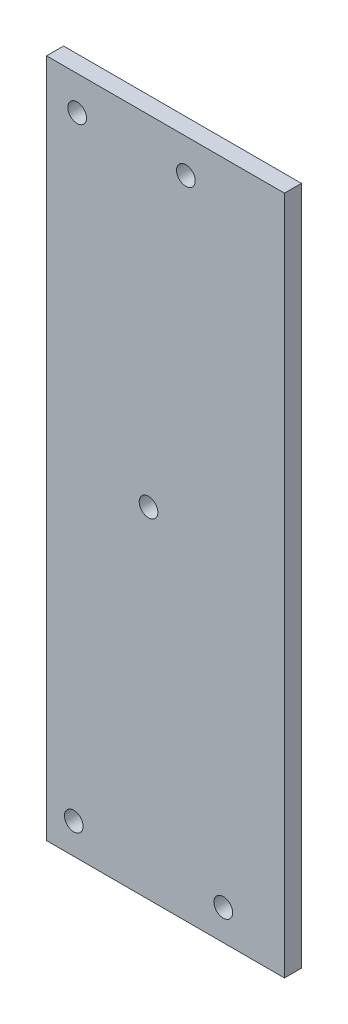
from build123d import *

# Parameters (mm, degrees)
SKETCH_1_W          = 100
SKETCH_1_H          = 200
EXTRUDE_1_DEPTH     = 5
CUT_EXTRUDE_2_DEPTH = 0.001
SKETCH_13_W         = 10
SKETCH_13_H         = 200
CUT_EXTRUDE_4_DEPTH = 10
SKETCH_14_W         = 10
SKETCH_14_H         = 200
CUT_EXTRUDE_5_DEPTH = 10
SKETCH_15_R         = 2.75
CUT_EXTRUDE_6_DEPTH = 108.819293394
SKETCH_17_R         = 2.75
CUT_EXTRUDE_8_DEPTH = 10
SKETCH_18_R         = 2.75
CUT_EXTRUDE_9_DEPTH = 10


with BuildPart() as part:
    # 스케치1 → 보스-돌출1 (new body)
    with BuildSketch(Plane.XY):
        Rectangle(SKETCH_1_W, SKETCH_1_H)
    extrude(amount=EXTRUDE_1_DEPTH)

    # 스케치3 → 컷-돌출2 (cut)
    # profile 1 of 5: a face of its own
    with BuildSketch(Plane(origin=(0, 0, 0), x_dir=(-1, 0, 0), z_dir=(0, 0, -1))):
        with BuildLine():
            Line((1.435897436, 3.568709936), (1.435897436, 3.241987179))
            add(Edge.make_bspline(
                [(1.435897436, 3.241987179), (1.406158657, 3.253938052), (1.349713836, 3.276621056), (1.26647346, 3.301285681), (1.189944626, 3.317221421), (1.140790736, 3.319457366), (1.117588141, 3.320512821)],
                knots=[0, 0, 0, 0, 1.16548392, 2.212112691, 3.15604595, 4, 4, 4, 4], degree=3))
            add(Edge.make_bspline(
                [(1.117588141, 3.320512821), (1.101914377, 3.31986148), (1.071575198, 3.318600703), (1.027971871, 3.312172427), (0.988682661, 3.299069626), (0.953777041, 3.28204035), (0.924826581, 3.260686166), (0.900040357, 3.239230902), (0.882073827, 3.215045722), (0.872318879, 3.192525311), (0.866368878, 3.171674318), (0.86457875, 3.150320052), (0.860193836, 3.124095966), (0.858971029, 3.091932248), (0.856183661, 3.054829537), (0.856430302, 3.012002641), (0.854146379, 2.964125498), (0.854488293, 2.930224949), (0.854667468, 2.912459936)],
                knots=[0, 0, 0, 0, 1.311993654, 2.539582093, 3.670788641, 4.763509788, 5.772417512, 6.671800701, 7.496729179, 8.266799162, 8.712543678, 9.304149002, 10.05334463, 10.934920737, 11.99209668, 13.165090968, 14.514413552, 16, 16, 16, 16], degree=3))
            Line((0.854667468, 2.912459936), (0.854667468, 2.557692308))
            Line((0.854667468, 2.557692308), (1.391025641, 2.557692308))
            Line((1.391025641, 2.557692308), (1.391025641, 2.243589744))
            Line((1.391025641, 2.243589744), (0.853966346, 2.243589744))
            Line((0.853966346, 2.243589744), (0.852564103, 0))
            Line((0.852564103, 0), (0.538461538, 0))
            Line((0.538461538, 0), (0.538461538, 2.243589744))
            Line((0.538461538, 2.243589744), (0.179487179, 2.243589744))
            Line((0.179487179, 2.243589744), (0.179487179, 2.557692308))
            Line((0.179487179, 2.557692308), (0.538461538, 2.557692308))
            Line((0.538461538, 2.557692308), (0.538461538, 2.966446314))
            add(Edge.make_bspline(
                [(0.538461538, 2.966446314), (0.538486753, 2.989121894), (0.538535124, 3.032622798), (0.541922975, 3.095232239), (0.544818696, 3.153055703), (0.550586323, 3.205644336), (0.557248029, 3.253490479), (0.566784189, 3.29588336), (0.57579556, 3.333965119), (0.592144152, 3.377067776), (0.616566371, 3.4259178), (0.656096568, 3.4775417), (0.703489575, 3.523846647), (0.760097899, 3.562854), (0.823813434, 3.595269478), (0.894694612, 3.618511331), (0.97196981, 3.631651776), (1.02545728, 3.633605985), (1.053084936, 3.634615385)],
                knots=[0, 0, 0, 0, 1.116398763, 2.141702935, 3.087165306, 3.966655413, 4.746276475, 5.464069668, 6.106083417, 6.67047701, 7.730773247, 8.782666744, 9.856985883, 10.980834087, 12.154321827, 13.366232824, 14.639591414, 16, 16, 16, 16], degree=3))
            add(Edge.make_bspline(
                [(1.053084936, 3.634615385), (1.081161694, 3.633658004), (1.140107358, 3.631648034), (1.232303961, 3.619214627), (1.331900478, 3.597743597), (1.400236399, 3.578665712), (1.435897436, 3.568709936)],
                knots=[0, 0, 0, 0, 0.864728408, 1.815451418, 2.859995356, 4, 4, 4, 4], degree=3))
        make_face()
    # profile 2 of 5: a face of its own
    with BuildSketch(Plane(origin=(0, 0, 0), x_dir=(-1, 0, 0), z_dir=(0, 0, -1))):
        with BuildLine():
            Line((1.794871795, 2.557692308), (2.108974359, 2.557692308))
            Line((2.108974359, 2.557692308), (2.108974359, 2.181189904))
            add(Edge.make_bspline(
                [(2.108974359, 2.181189904), (2.132163118, 2.216245732), (2.176511439, 2.283289731), (2.250224368, 2.371959032), (2.325727699, 2.445374079), (2.403382887, 2.503877598), (2.483760987, 2.547690717), (2.565097938, 2.579783752), (2.648673408, 2.598761067), (2.704835332, 2.601294726), (2.732972756, 2.602564103)],
                knots=[0, 0, 0, 0, 1.2804753, 2.448899062, 3.506932113, 4.484331642, 5.4025378, 6.288909075, 7.142734305, 8, 8, 8, 8], degree=3))
            add(Edge.make_bspline(
                [(2.732972756, 2.602564103), (2.754799083, 2.601373576), (2.799708168, 2.59892399), (2.867690758, 2.581713165), (2.93773421, 2.554235143), (2.982876597, 2.52839492), (3.006410256, 2.514923878)],
                knots=[0, 0, 0, 0, 0.901110191, 1.854092781, 2.881294221, 4, 4, 4, 4], degree=3))
            Line((3.006410256, 2.514923878), (2.833934295, 2.242888622))
            add(Edge.make_bspline(
                [(2.833934295, 2.242888622), (2.818825274, 2.249628888), (2.790145459, 2.262423203), (2.748190893, 2.277565213), (2.709509556, 2.286481129), (2.684865998, 2.287831847), (2.673377404, 2.288461538)],
                knots=[0, 0, 0, 0, 1.180555205, 2.24091978, 3.179933427, 4, 4, 4, 4], degree=3))
            add(Edge.make_bspline(
                [(2.673377404, 2.288461538), (2.64817167, 2.286781501), (2.59675928, 2.283354712), (2.521274781, 2.256415904), (2.448027575, 2.212890664), (2.389855913, 2.164619552), (2.34481366, 2.118071755), (2.312673435, 2.077423352), (2.283190688, 2.031844721), (2.255020467, 1.982115037), (2.229354173, 1.927385191), (2.205399504, 1.868201977), (2.183740641, 1.804496849), (2.171390397, 1.760114328), (2.165064103, 1.737379808)],
                knots=[0, 0, 0, 0, 1.125678352, 2.296057538, 3.5422874, 4.923748041, 5.663163013, 6.437101912, 7.23742474, 8.08941207, 8.991984279, 9.93940061, 10.944477711, 12, 12, 12, 12], degree=3))
            add(Edge.make_bspline(
                [(2.165064103, 1.737379808), (2.160331709, 1.717102634), (2.149849818, 1.672190235), (2.13965828, 1.596841711), (2.129588762, 1.507818052), (2.122492143, 1.404871459), (2.115914101, 1.288259015), (2.112204019, 1.15780307), (2.109100878, 1.013369718), (2.109017812, 0.912395365), (2.108974359, 0.859575321)],
                knots=[0, 0, 0, 0, 0.566838948, 1.255505196, 2.06880316, 3.007127437, 4.065329342, 5.249902469, 6.561414163, 8, 8, 8, 8], degree=3))
            Line((2.108974359, 0.859575321), (2.108974359, 0))
            Line((2.108974359, 0), (1.794871795, 0))
            Line((1.794871795, 0), (1.794871795, 2.557692308))
        make_face()
    # profile 3 of 5: a face of its own
    with BuildSketch(Plane(origin=(0, 0, 0), x_dir=(-1, 0, 0), z_dir=(0, 0, -1))):
        with BuildLine():
            add(Edge.make_bspline(
                [(4.555889423, 2.602564103), (4.603880696, 2.601542211), (4.697979853, 2.599538533), (4.835787739, 2.578123567), (4.967332875, 2.545376203), (5.093119067, 2.500104641), (5.211535363, 2.43942269), (5.324306607, 2.367013399), (5.431123616, 2.281230805), (5.495146645, 2.214872737), (5.527644231, 2.181189904)],
                knots=[0, 0, 0, 0, 1.054011418, 2.066658804, 3.057071809, 4.030435133, 4.997543892, 5.974964718, 6.972108034, 8, 8, 8, 8], degree=3))
            add(Edge.make_bspline(
                [(5.527644231, 2.181189904), (5.555626185, 2.148975918), (5.611048565, 2.085171376), (5.682114284, 1.981715763), (5.743335844, 1.874575662), (5.792398805, 1.762328336), (5.831083829, 1.645953664), (5.858549525, 1.525051653), (5.87488646, 1.399889306), (5.877089427, 1.314885468), (5.878205128, 1.271834936)],
                knots=[0, 0, 0, 0, 1.025258237, 2.030674902, 3.01204498, 3.988269485, 4.97094183, 5.956517959, 6.965070386, 8, 8, 8, 8], degree=3))
            add(Edge.make_bspline(
                [(5.878205128, 1.271834936), (5.877223791, 1.228534878), (5.875284623, 1.142971945), (5.856941006, 1.016952579), (5.82840992, 0.894757756), (5.787578082, 0.776899063), (5.735219973, 0.663016235), (5.671329285, 0.553606686), (5.595457668, 0.448454553), (5.509453671, 0.348452714), (5.414401795, 0.2562865), (5.311285647, 0.17595823), (5.202131613, 0.107136706), (5.08548826, 0.05170029), (4.962420773, 0.00799059), (4.832663705, -0.022709427), (4.696418635, -0.04127111), (4.603391413, -0.043654684), (4.555889423, -0.044871795)],
                knots=[0, 0, 0, 0, 0.998656419, 1.973391657, 2.932242238, 3.890759089, 4.846373663, 5.82037756, 6.809684879, 7.83454468, 8.860553229, 9.859544525, 10.845671541, 11.83227036, 12.833544569, 13.85385346, 14.904124723, 16, 16, 16, 16], degree=3))
            add(Edge.make_bspline(
                [(4.555889423, -0.044871795), (4.508154704, -0.043650599), (4.414663844, -0.041258824), (4.277937862, -0.022781541), (4.147948243, 0.007976441), (4.024719644, 0.051843934), (3.907574798, 0.107138478), (3.797788301, 0.175750167), (3.694588385, 0.256310322), (3.599516401, 0.348446259), (3.513517795, 0.448456216), (3.437644787, 0.553606254), (3.373754461, 0.663016348), (3.321396257, 0.776899033), (3.280564444, 0.894757764), (3.252033351, 1.016952577), (3.233689737, 1.142971945), (3.231750568, 1.228534878), (3.230769231, 1.271834936)],
                knots=[0, 0, 0, 0, 1.099876186, 2.154163076, 3.173186993, 4.173200201, 5.163417411, 6.152872554, 7.150605724, 8.17532212, 9.198891216, 10.186952605, 11.159729845, 12.11414092, 13.071450619, 14.029093627, 15.002601286, 16, 16, 16, 16], degree=3))
            add(Edge.make_bspline(
                [(3.230769231, 1.271834936), (3.231892541, 1.314651482), (3.234116503, 1.399420884), (3.250437012, 1.524347945), (3.277795568, 1.645045334), (3.316526965, 1.76097081), (3.366042155, 1.872726246), (3.426403443, 1.980131077), (3.498194076, 2.083118877), (3.553396027, 2.146840957), (3.581330128, 2.179086538)],
                knots=[0, 0, 0, 0, 1.031353054, 2.041901799, 3.029428768, 4.008703097, 4.981709435, 5.96992636, 6.972712378, 8, 8, 8, 8], degree=3))
            add(Edge.make_bspline(
                [(3.581330128, 2.179086538), (3.613778719, 2.213061478), (3.677594583, 2.279879174), (3.784943311, 2.365411698), (3.897437132, 2.439327772), (4.017162058, 2.498803987), (4.142844916, 2.545642505), (4.275064159, 2.57820802), (4.413339674, 2.599461375), (4.507899295, 2.601519553), (4.555889423, 2.602564103)],
                knots=[0, 0, 0, 0, 1.027980169, 2.021703884, 2.998553061, 3.971491411, 4.943284454, 5.930300938, 6.949603206, 8, 8, 8, 8], degree=3))
        make_face()
        with BuildLine():
            add(Edge.make_bspline(
                [(4.554487179, 2.288461538), (4.520549568, 2.287496947), (4.453550439, 2.285592664), (4.354930855, 2.27110876), (4.259990701, 2.248161255), (4.168549857, 2.215557199), (4.080916684, 2.1734583), (3.997007282, 2.12174994), (3.916574842, 2.061116984), (3.841192779, 1.991654312), (3.772010466, 1.915775317), (3.71153249, 1.834926959), (3.660107384, 1.750420612), (3.617267225, 1.662168401), (3.585360036, 1.569275987), (3.562187014, 1.472795356), (3.547716774, 1.37252994), (3.545830395, 1.304368921), (3.544871795, 1.269731571)],
                knots=[0, 0, 0, 0, 1.021534396, 2.016698045, 2.994645724, 3.958388632, 4.93408049, 5.916473867, 6.921342795, 7.962252576, 8.998418191, 10.008913653, 10.997312074, 11.973003931, 12.956656626, 13.948281152, 14.957379055, 16, 16, 16, 16], degree=3))
            add(Edge.make_bspline(
                [(3.544871795, 1.269731571), (3.546478619, 1.224979543), (3.549667863, 1.136155138), (3.575603099, 1.005344015), (3.618989379, 0.879762163), (3.677576659, 0.760145777), (3.750982878, 0.649473499), (3.837469944, 0.550802015), (3.936109645, 0.465616203), (4.045726145, 0.394935358), (4.164080463, 0.338775602), (4.289336784, 0.298976626), (4.419977478, 0.273104934), (4.509258209, 0.270533459), (4.554487179, 0.269230769)],
                knots=[0, 0, 0, 0, 1.016792936, 2.018143844, 3.017858371, 4.030088057, 5.03801393, 6.028138512, 7.003788237, 7.991172063, 8.984598303, 9.972568034, 10.972917682, 12, 12, 12, 12], degree=3))
            add(Edge.make_bspline(
                [(4.554487179, 0.269230769), (4.599713548, 0.270541049), (4.688989144, 0.273127506), (4.819448321, 0.298846326), (4.944362293, 0.338949987), (5.062593681, 0.394872197), (5.172160284, 0.465884611), (5.271509405, 0.550320988), (5.357258017, 0.64973484), (5.430591621, 0.760292369), (5.490138364, 0.879576721), (5.533321566, 1.005367193), (5.559319152, 1.136149235), (5.562499981, 1.224977566), (5.564102564, 1.269731571)],
                knots=[0, 0, 0, 0, 1.02726834, 2.027799167, 3.010890988, 4.004497153, 4.992059811, 5.971914811, 6.958719428, 7.966827853, 8.981595046, 9.981490638, 10.983022906, 12, 12, 12, 12], degree=3))
            add(Edge.make_bspline(
                [(5.564102564, 1.269731571), (5.563144294, 1.304369128), (5.561258565, 1.372530554), (5.546783601, 1.472793007), (5.523628061, 1.569284604), (5.491656444, 1.662136607), (5.44900243, 1.750649112), (5.396585637, 1.834678839), (5.336354611, 1.916055385), (5.26633749, 1.991409026), (5.191034113, 2.061144062), (5.110569074, 2.121773452), (5.026784096, 2.173231047), (4.939405513, 2.215917288), (4.847952945, 2.247864628), (4.753145816, 2.271241259), (4.654947006, 2.285531456), (4.588187963, 2.287478598), (4.554487179, 2.288461538)],
                knots=[0, 0, 0, 0, 1.042956736, 2.052379634, 3.044323526, 4.02829302, 5.004299113, 5.996692471, 7.007513377, 8.048758398, 9.090003419, 10.095195979, 11.07790575, 12.047570684, 13.018257071, 13.989683339, 14.985167495, 16, 16, 16, 16], degree=3))
        make_face(mode=Mode.SUBTRACT)
    # profile 4 of 5: a face of its own
    with BuildSketch(Plane(origin=(0, 0, 0), x_dir=(-1, 0, 0), z_dir=(0, 0, -1))):
        with BuildLine():
            Line((6.506410256, 2.557692308), (6.820512821, 2.557692308))
            Line((6.820512821, 2.557692308), (6.820512821, 2.096354167))
            add(Edge.make_bspline(
                [(6.820512821, 2.096354167), (6.854050456, 2.13819689), (6.919131407, 2.219394153), (7.02751574, 2.326114728), (7.14205964, 2.414059953), (7.262061644, 2.484163747), (7.387684654, 2.537010373), (7.518162924, 2.575176304), (7.65427763, 2.598061132), (7.746842067, 2.601051363), (7.793669872, 2.602564103)],
                knots=[0, 0, 0, 0, 1.12780773, 2.188550248, 3.19190651, 4.159438251, 5.104880172, 6.052711206, 7.014878035, 8, 8, 8, 8], degree=3))
            add(Edge.make_bspline(
                [(7.793669872, 2.602564103), (7.841000506, 2.600818907), (7.933637974, 2.597403139), (8.068516035, 2.570386448), (8.194489429, 2.524241192), (8.311108985, 2.461029122), (8.416236198, 2.382422649), (8.508561049, 2.290844867), (8.584924297, 2.185508784), (8.63612166, 2.087785627), (8.669847307, 2.001096833), (8.691079645, 1.926850083), (8.709110626, 1.844131932), (8.724742374, 1.753192343), (8.735319486, 1.653394153), (8.743661778, 1.545146461), (8.749640472, 1.42848433), (8.749877679, 1.347797703), (8.75, 1.306189904)],
                knots=[0, 0, 0, 0, 1.235846778, 2.418850247, 3.575807741, 4.728682307, 5.871620074, 6.994088408, 8.11269785, 9.256955736, 9.865816715, 10.540099792, 11.271859618, 12.076849838, 12.949306005, 13.892391288, 14.913166135, 16, 16, 16, 16], degree=3))
            Line((8.75, 1.306189904), (8.75, 0))
            Line((8.75, 0), (8.435897436, 0))
            Line((8.435897436, 0), (8.435897436, 1.203125))
            add(Edge.make_bspline(
                [(8.435897436, 1.203125), (8.435704228, 1.237947445), (8.435334654, 1.304556856), (8.434169007, 1.399925879), (8.431359201, 1.486412457), (8.427410888, 1.563809825), (8.421631857, 1.632043661), (8.415609226, 1.691252938), (8.408244249, 1.74136248), (8.401681336, 1.771527563), (8.398737981, 1.78505609)],
                knots=[0, 0, 0, 0, 1.430800155, 2.736877192, 3.918605307, 4.986035426, 5.920637409, 6.731861385, 7.431261377, 8, 8, 8, 8], degree=3))
            add(Edge.make_bspline(
                [(8.398737981, 1.78505609), (8.388112449, 1.824767275), (8.367661589, 1.901199019), (8.317127605, 2.004873372), (8.253313425, 2.09307156), (8.175415575, 2.165248281), (8.0841865, 2.221419118), (7.979879357, 2.260393073), (7.863500716, 2.284769342), (7.781646334, 2.287196474), (7.738982372, 2.288461538)],
                knots=[0, 0, 0, 0, 1.084156227, 2.086665306, 3.027808233, 3.945421172, 4.874247719, 5.839848303, 6.874090471, 8, 8, 8, 8], degree=3))
            add(Edge.make_bspline(
                [(7.738982372, 2.288461538), (7.713714688, 2.287985534), (7.663710595, 2.287043533), (7.589560623, 2.277592235), (7.51763645, 2.262133779), (7.447216241, 2.241265142), (7.379708447, 2.212602873), (7.312944156, 2.180073502), (7.249437392, 2.13952529), (7.187833995, 2.094334669), (7.130521187, 2.044255462), (7.077192849, 1.991410952), (7.029654829, 1.935135348), (6.986586153, 1.8763354), (6.94940789, 1.814203562), (6.916954802, 1.749339256), (6.889419107, 1.681657107), (6.875736415, 1.634682046), (6.868890224, 1.611177885)],
                knots=[0, 0, 0, 0, 1.023777757, 2.026029729, 3.023749952, 4.003683103, 4.997618607, 5.993177895, 7.010360494, 8.046726602, 9.087585522, 10.09234134, 11.086953743, 12.070360549, 13.043493632, 14.017870808, 15.008233677, 16, 16, 16, 16], degree=3))
            add(Edge.make_bspline(
                [(6.868890224, 1.611177885), (6.864950576, 1.593922682), (6.856374167, 1.556359007), (6.847110987, 1.494714588), (6.838703412, 1.423404613), (6.831666453, 1.342512296), (6.827361037, 1.251754421), (6.82266664, 1.151518583), (6.820957579, 1.041405094), (6.820665225, 0.964743402), (6.820512821, 0.924779647)],
                knots=[0, 0, 0, 0, 0.615963638, 1.340920617, 2.168419149, 3.115676021, 4.16674242, 5.331190069, 6.6087489, 8, 8, 8, 8], degree=3))
            Line((6.820512821, 0.924779647), (6.820512821, 0))
            Line((6.820512821, 0), (6.506410256, 0))
            Line((6.506410256, 0), (6.506410256, 2.557692308))
        make_face()
    # profile 5 of 5: a face of its own
    with BuildSketch(Plane(origin=(0, 0, 0), x_dir=(-1, 0, 0), z_dir=(0, 0, -1))):
        Polygon((9.782051282, 3.58974359), (10.096153846, 3.58974359), (10.096153846, 2.557692308), (10.544871795, 2.557692308), (10.544871795, 2.243589744), (10.096153846, 2.243589744), (10.096153846, 0), (9.782051282, 0), (9.782051282, 2.243589744), (9.333333333, 2.243589744), (9.333333333, 2.557692308), (9.782051282, 2.557692308), align=None)
    extrude(amount=-CUT_EXTRUDE_2_DEPTH, mode=Mode.SUBTRACT)

    # 스케치13 → 컷-돌출4 (cut)
    with BuildSketch(Plane.XY.offset(5)):
        with Locations((45, 0)):
            Rectangle(SKETCH_13_W, SKETCH_13_H)
        with Locations((-45, 0)):
            Rectangle(SKETCH_13_W, SKETCH_13_H)
    extrude(amount=-CUT_EXTRUDE_4_DEPTH, mode=Mode.SUBTRACT)

    # 스케치14 → 컷-돌출5 (cut)
    with BuildSketch(Plane.XY.offset(5)):
        with Locations((35, 0)):
            Rectangle(SKETCH_14_W, SKETCH_14_H)
    extrude(amount=-CUT_EXTRUDE_5_DEPTH, mode=Mode.SUBTRACT)

    # 스케치15 → 컷-돌출6 (cut, through all)
    with BuildSketch(Plane(origin=(0, 0, 0), x_dir=(-1, 0, 0), z_dir=(0, 0, -1))):
        with Locations((-1, 90)):
            Circle(SKETCH_15_R)
        with Locations((31, 90)):
            Circle(SKETCH_15_R)
    extrude(amount=-CUT_EXTRUDE_6_DEPTH, mode=Mode.SUBTRACT)

    # 스케치17 → 컷-돌출8 (cut)
    with BuildSketch(Plane(origin=(0, 0, 0), x_dir=(-1, 0, 0), z_dir=(0, 0, -1))):
        with Locations(Location((10, 0, 0), (0, 0, 87.996242641))):
            Circle(SKETCH_17_R)
    extrude(amount=-CUT_EXTRUDE_8_DEPTH, mode=Mode.SUBTRACT)

    # 스케치18 → 컷-돌출9 (cut)
    with BuildSketch(Plane(origin=(0, 0, 0), x_dir=(-1, 0, 0), z_dir=(0, 0, -1))):
        with Locations((32, -91)):
            Circle(SKETCH_18_R)
        with Locations((-12, -91)):
            Circle(SKETCH_18_R)
    extrude(amount=-CUT_EXTRUDE_9_DEPTH, mode=Mode.SUBTRACT)


solid = part.part
